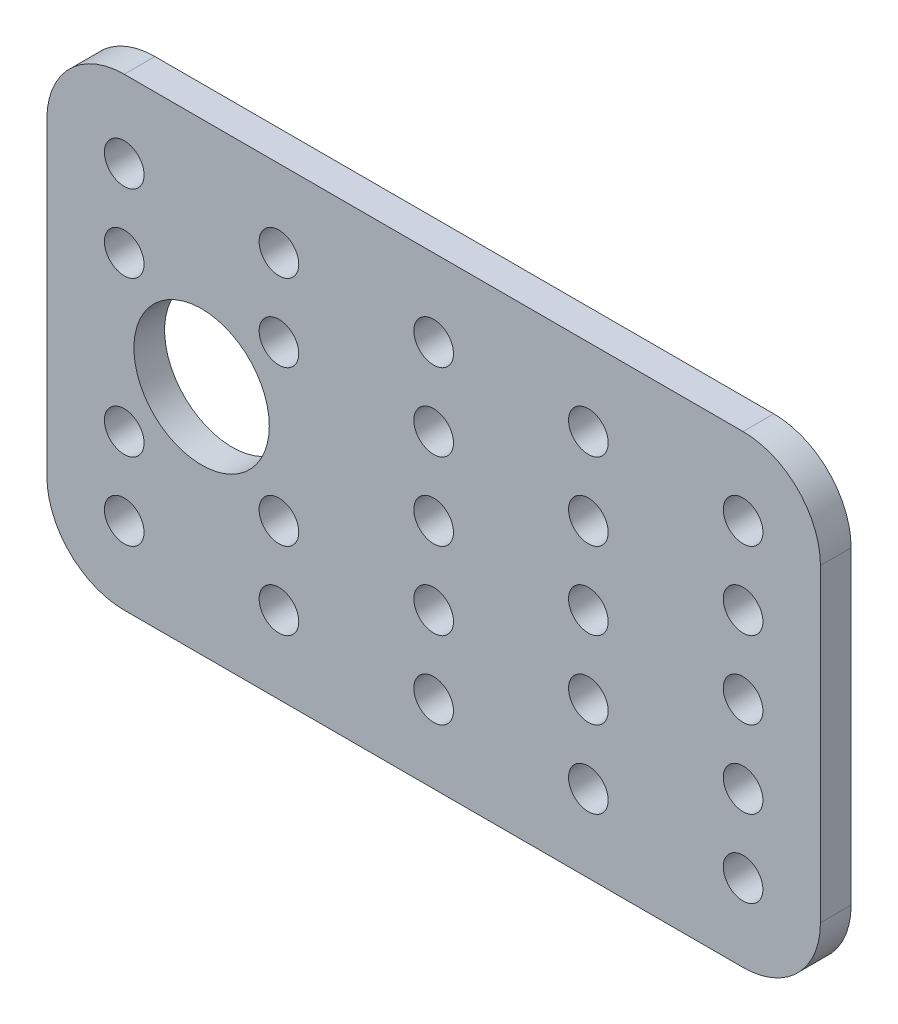
from build123d import *

# Parameters (mm, degrees)
SKETCH1_W           = 80
SKETCH1_H           = 48
SKETCH1_R           = 7
SKETCH1_R_2         = 2.05
BOSS_EXTRUDE1_DEPTH = 3.175
FILLET1_R           = 8


with BuildPart() as part:
    # Sketch1 → Boss-Extrude1 (new body)
    with BuildSketch(Plane.XY):
        Rectangle(SKETCH1_W, SKETCH1_H)
        with Locations((-24, 0)):
            Circle(SKETCH1_R, mode=Mode.SUBTRACT)
        with Locations((-32, 16)):
            Circle(SKETCH1_R_2, mode=Mode.SUBTRACT)
        with Locations((-16, 16)):
            Circle(SKETCH1_R_2, mode=Mode.SUBTRACT)
        with Locations((0, 16)):
            Circle(SKETCH1_R_2, mode=Mode.SUBTRACT)
        with Locations((16, 16)):
            Circle(SKETCH1_R_2, mode=Mode.SUBTRACT)
        with Locations((32, 16)):
            Circle(SKETCH1_R_2, mode=Mode.SUBTRACT)
        with Locations((-16, 8)):
            Circle(SKETCH1_R_2, mode=Mode.SUBTRACT)
        with Locations((0, 8)):
            Circle(SKETCH1_R_2, mode=Mode.SUBTRACT)
        with Locations((16, 8)):
            Circle(SKETCH1_R_2, mode=Mode.SUBTRACT)
        with Locations((32, 8)):
            Circle(SKETCH1_R_2, mode=Mode.SUBTRACT)
        Circle(SKETCH1_R_2, mode=Mode.SUBTRACT)
        with Locations((16, 0)):
            Circle(SKETCH1_R_2, mode=Mode.SUBTRACT)
        with Locations((32, 0)):
            Circle(SKETCH1_R_2, mode=Mode.SUBTRACT)
        with Locations((-16, -8)):
            Circle(SKETCH1_R_2, mode=Mode.SUBTRACT)
        with Locations((0, -8)):
            Circle(SKETCH1_R_2, mode=Mode.SUBTRACT)
        with Locations((16, -8)):
            Circle(SKETCH1_R_2, mode=Mode.SUBTRACT)
        with Locations((32, -8)):
            Circle(SKETCH1_R_2, mode=Mode.SUBTRACT)
        with Locations((-16, -16)):
            Circle(SKETCH1_R_2, mode=Mode.SUBTRACT)
        with Locations((0, -16)):
            Circle(SKETCH1_R_2, mode=Mode.SUBTRACT)
        with Locations((16, -16)):
            Circle(SKETCH1_R_2, mode=Mode.SUBTRACT)
        with Locations((32, -16)):
            Circle(SKETCH1_R_2, mode=Mode.SUBTRACT)
        with Locations((-32, 8)):
            Circle(SKETCH1_R_2, mode=Mode.SUBTRACT)
        with Locations((-32, -8)):
            Circle(SKETCH1_R_2, mode=Mode.SUBTRACT)
        with Locations((-32, -16)):
            Circle(SKETCH1_R_2, mode=Mode.SUBTRACT)
    extrude(amount=BOSS_EXTRUDE1_DEPTH)

    # Fillet1
    fillet1_edges = [part.edges().sort_by_distance(p)[0] for p in [
        (-40, 24, 1.5875),
        (40, 24, 1.5875),
        (40, -24, 1.5875),
        (-40, -24, 1.5875),
    ]]
    fillet(fillet1_edges, radius=FILLET1_R)


solid = part.part
